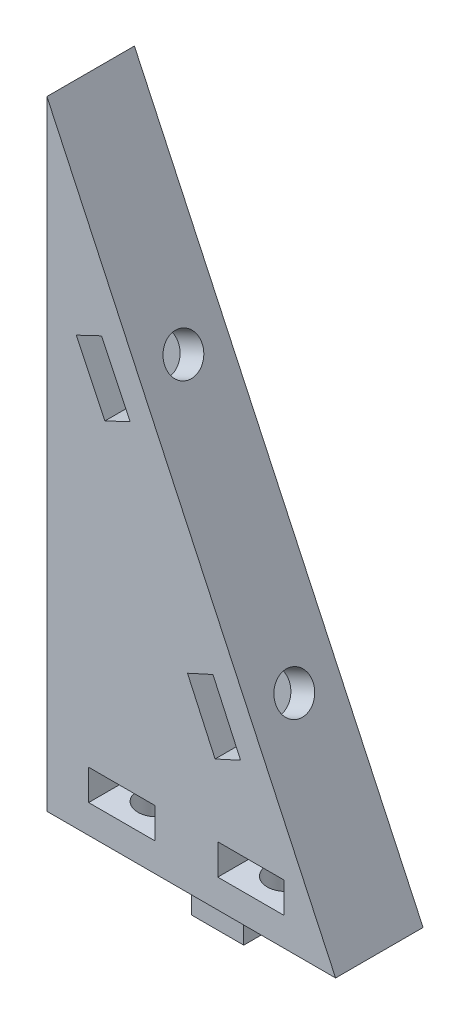
from build123d import *

# Parameters (mm, degrees)
BOSS_EXTRUDE1_DEPTH = 10
SKETCH2_W           = 6
SKETCH2_H           = 4
BOSS_EXTRUDE2_DEPTH = 5
SKETCH3_R           = 2.15
CUT_EXTRUDE1_DEPTH  = 12
SKETCH6_R           = 2.15
CUT_EXTRUDE4_DEPTH  = 7.3
CUT_EXTRUDE5_START  = -10
SKETCH4_W           = 7.6
SKETCH4_H           = 3.5
CUT_EXTRUDE5_DEPTH  = 6.5
SKETCH7_W           = 7.6
SKETCH7_H           = 3.5
CUT_EXTRUDE6_DEPTH  = 6.5
CUT_EXTRUDE7_DEPTH  = 7.5


with BuildPart() as part:
    # Sketch1 → Boss-Extrude1 (new body)
    with BuildSketch(Plane.XY):
        Polygon((0, 70.768728377), (0, 0), (33, 0), align=None)
    extrude(amount=BOSS_EXTRUDE1_DEPTH)

    # Sketch2 → Boss-Extrude2 (add)
    with BuildSketch(Plane(origin=(0, 0, 0), x_dir=(-1, 0, 0), z_dir=(0, -1, 0))):
        with Locations((-16.5, -5)):
            Rectangle(SKETCH2_W, SKETCH2_H)
    extrude(amount=BOSS_EXTRUDE2_DEPTH)

    # Sketch3 → Cut-Extrude1 (cut)
    with BuildSketch(Plane(origin=(0, 0, 0), x_dir=(-1, 0, 0), z_dir=(0, -1, 0))):
        with Locations(Location((-23.33, -6, 0), (0, 0, 180))):
            Circle(SKETCH3_R)
        with Locations(Location((-8.55, -6, 0), (0, 0, 180))):
            Circle(SKETCH3_R)
    extrude(amount=-CUT_EXTRUDE1_DEPTH, mode=Mode.SUBTRACT)

    # Sketch6 → Cut-Extrude4 (cut)
    with BuildSketch(Plane(origin=(27.10599556, 12.639733311, 0), x_dir=(0, 0, -1), z_dir=(0.9063077870366479, 0.422618261740704, 0))):
        with Locations(Location((-5, 9.053597363, 0), (0, 0, 90))):
            Circle(SKETCH6_R)
        with Locations(Location((-5, 39.053597363, 0), (0, 0, 90))):
            Circle(SKETCH6_R)
    extrude(amount=-CUT_EXTRUDE4_DEPTH, mode=Mode.SUBTRACT)

    # Sketch4 → Cut-Extrude5 (cut)
    with BuildSketch(Plane(origin=(0, 0, 0), x_dir=(-1, 0, 0), z_dir=(0, 0, -1)).offset(CUT_EXTRUDE5_START)):
        with Locations((-23.33, 5.001728642)):
            Rectangle(SKETCH4_W, SKETCH4_H)
    extrude(amount=CUT_EXTRUDE5_DEPTH, mode=Mode.SUBTRACT)

    # Sketch7 → Cut-Extrude6 (cut)
    with BuildSketch(Plane.XY.offset(10)):
        with Locations((8.567911565, 5.001728642)):
            Rectangle(SKETCH7_W, SKETCH7_H)
    extrude(amount=-CUT_EXTRUDE6_DEPTH, mode=Mode.SUBTRACT)

    # Sketch9 → Cut-Extrude7 (cut)
    with BuildSketch(Plane.XY.offset(10)):
        Polygon((7.880441317, 46.768813524), (6.246018546, 50.199361906), (3.357135698, 48.823005888), (6.625981241, 41.961909123), (9.514864089, 43.338265141), align=None)
        Polygon((18.980916312, 23.03825064), (20.55828213, 19.581096164), (22.135647949, 16.123941687), (19.224359969, 14.795633629), (16.069628331, 21.709942582), align=None)
    extrude(amount=-CUT_EXTRUDE7_DEPTH, mode=Mode.SUBTRACT)


solid = part.part
